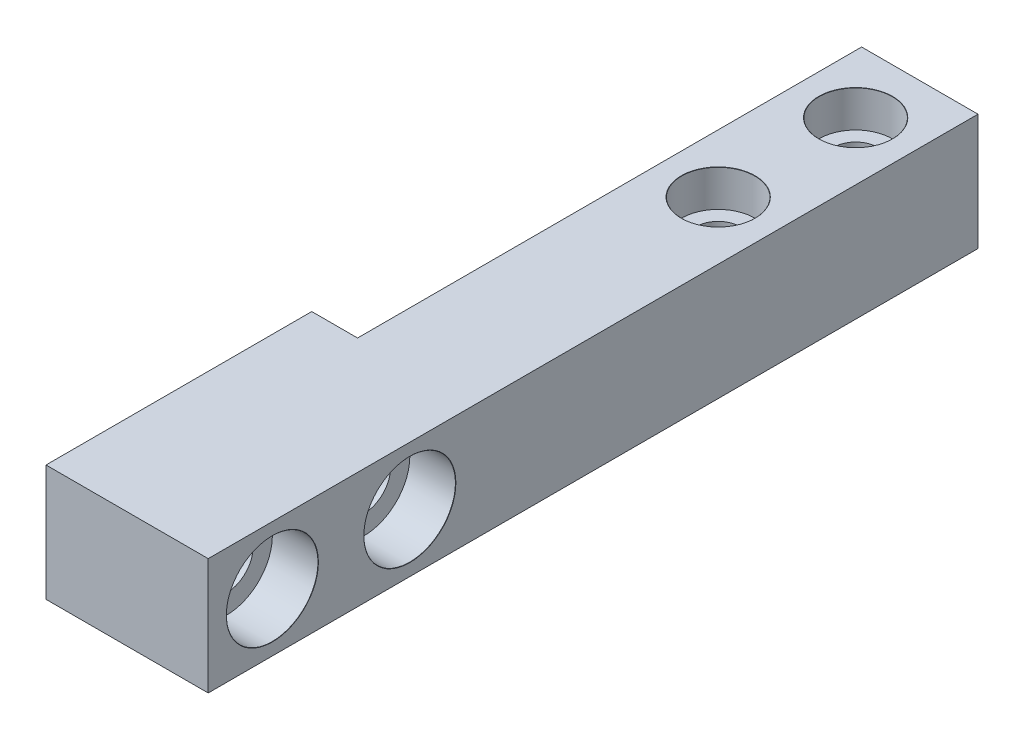
from build123d import *

# Parameters (mm, degrees)
SKETCH2_W                     = 12.7
SKETCH2_H                     = 84
BOSS_EXTRUDE1_DEPTH           = 12.7
CBORE_FOR_M4_SHCS1_AT_2_COUNT = 2
CBORE_FOR_M4_SHCS1_AT_2_PITCH = 15
SKETCH8_W                     = 29
SKETCH8_H                     = 12.7
BOSS_EXTRUDE3_DEPTH           = 5
CBORE_FOR_M5_SHCS2_AT_2_COUNT = 2
CBORE_FOR_M5_SHCS2_AT_2_PITCH = 15


with BuildPart() as part:
    # Sketch2 → Boss-Extrude1 (new body)
    with BuildSketch(Plane(origin=(0, 0, 0), x_dir=(1, 0, 0), z_dir=(0, 1, 0))):
        Rectangle(SKETCH2_W, SKETCH2_H)
    extrude(amount=BOSS_EXTRUDE1_DEPTH)

    # Sketch4 → CBORE for M4 SHCS1 (revolve, cut)
    with BuildSketch(Plane(origin=(0, 12.7, -35), x_dir=(0, 0, 1), z_dir=(1, 0, 0))):
        Polygon((0, 0), (0, 12.7), (2.4, 12.7), (2.4, 4), (4, 4), (4, 0.020977491), (4.025, 0), align=None)
    cbore_for_m4_shcs1 = revolve(axis=Axis((0, 19.05, -35), (0, -1, 0)), mode=Mode.SUBTRACT)

    # CBORE for M4 SHCS1 at 2: CBORE for M4 SHCS1 ×2
    with Locations(*[(0, 0, i * CBORE_FOR_M4_SHCS1_AT_2_PITCH) for i in range(1, CBORE_FOR_M4_SHCS1_AT_2_COUNT)]):
        add(cbore_for_m4_shcs1, mode=Mode.SUBTRACT)

    # Sketch8 → Boss-Extrude3 (add)
    with BuildSketch(Plane.ZY.offset(6.35)):
        with Locations((27.5, 6.35)):
            Rectangle(SKETCH8_W, SKETCH8_H)
    extrude(amount=BOSS_EXTRUDE3_DEPTH)

    # Sketch7 → CBORE for M5 SHCS2 (revolve, cut)
    with BuildSketch(Plane(origin=(6.35, 6.35, 35), x_dir=(0, 0, -1), z_dir=(0, 1, 0))):
        Polygon((0, 0), (0, 17.7), (2.9, 17.7), (2.9, 5), (5, 5), (5, 0.020977491), (5.025, 0), align=None)
    cbore_for_m5_shcs2 = revolve(axis=Axis((12.7, 6.35, 35), (-1, 0, 0)), mode=Mode.SUBTRACT)

    # CBORE for M5 SHCS2 at 2: CBORE for M5 SHCS2 ×2
    with Locations(*[(0, 0, -i * CBORE_FOR_M5_SHCS2_AT_2_PITCH) for i in range(1, CBORE_FOR_M5_SHCS2_AT_2_COUNT)]):
        add(cbore_for_m5_shcs2, mode=Mode.SUBTRACT)


solid = part.part
